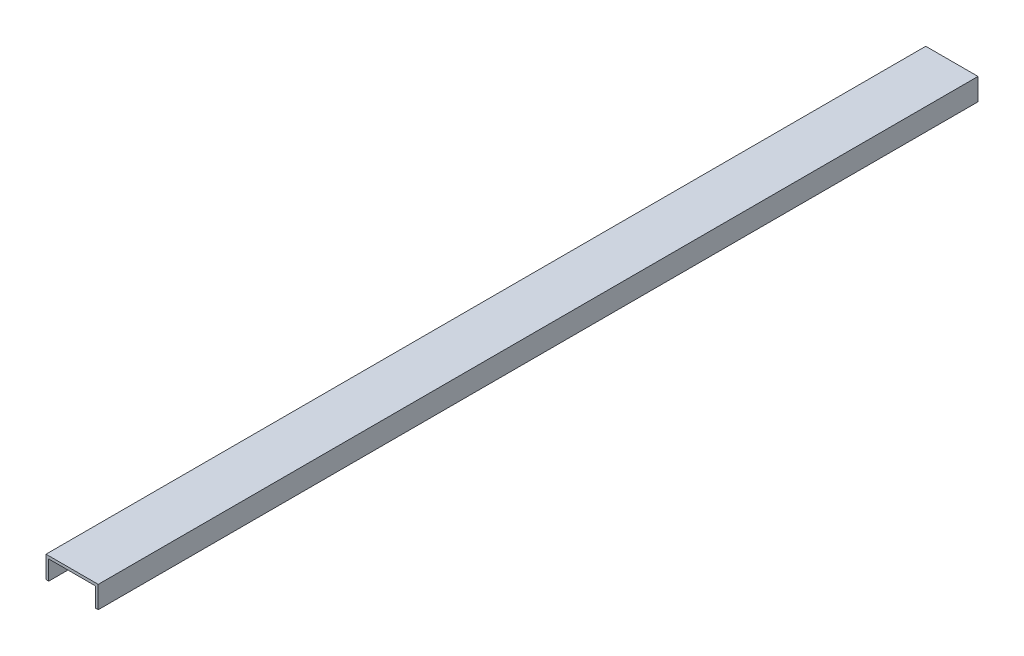
from build123d import *

# Parameters (mm, degrees)
BOSS_EXTRUDE1_DEPTH = 320


with BuildPart() as part:
    # Sketch1 → Boss-Extrude1 (new body)
    with BuildSketch(Plane.XY):
        Polygon((0, 0), (-8.5, 0), (-8.5, -7), (-9.5, -7), (-9.5, 1), (9.5, 1), (9.5, -7), (8.5, -7), (8.5, 0), align=None)
    extrude(amount=BOSS_EXTRUDE1_DEPTH)


solid = part.part
